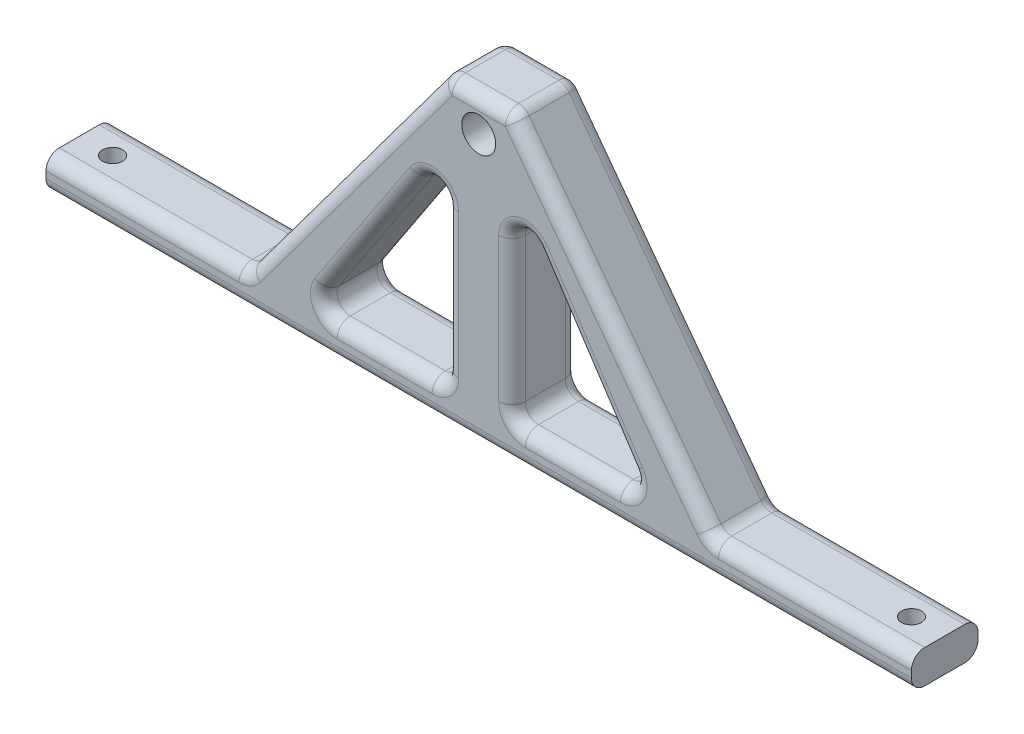
from build123d import *

# Parameters (mm, degrees)
SKETCH1_R           = 2.55
BOSS_EXTRUDE1_DEPTH = 10
SKETCH2_R           = 1.5
CUT_EXTRUDE1_DEPTH  = 5
FILLET1_R           = 2
FILLET2_R           = 2


with BuildPart() as part:
    # Sketch1 → Boss-Extrude1 (new body)
    with BuildSketch(Plane.XY):
        Polygon((-21.861045086, 19.601121192), (-11.861045086, 19.601121192), (18.138954914, -20.678878808), (48.138954914, -20.678878808), (48.138954914, -25.678878808), (-81.861045086, -25.678878808), (-81.861045086, -20.678878808), (-51.861045086, -20.678878808), align=None)
        with Locations((-16.861045086, 14.601121192)):
            Circle(SKETCH1_R, mode=Mode.SUBTRACT)
        Polygon((-41.861045086, -20.678878808), (-21.861045086, 9.601121192), (-21.861045086, -20.678878808), align=None, mode=Mode.SUBTRACT)
        Polygon((-11.861045086, 9.601121192), (-11.861045086, -20.678878808), (8.138954914, -20.678878808), align=None, mode=Mode.SUBTRACT)
    extrude(amount=BOSS_EXTRUDE1_DEPTH)

    # Sketch2 → Cut-Extrude1 (cut)
    with BuildSketch(Plane(origin=(0, -20.678878808, 0), x_dir=(1, 0, 0), z_dir=(0, 1, 0))):
        with Locations(Location((43.138954914, -5, 0), (0, 0, 180))):
            Circle(SKETCH2_R)
        with Locations(Location((-76.861045086, -5, 0), (0, 0, 180))):
            Circle(SKETCH2_R)
    extrude(amount=-CUT_EXTRUDE1_DEPTH, mode=Mode.SUBTRACT)

    # Fillet1
    fillet1_edges = [part.edges().sort_by_distance(p)[0] for p in [
        (-21.861045086, 19.601121192, 5),
        (-11.861045086, 19.601121192, 5),
        (18.138954914, -20.678878808, 5),
        (-51.861045086, -20.678878808, 5),
        (-41.861045086, -20.678878808, 5),
        (-21.861045086, -20.678878808, 5),
        (-21.861045086, 9.601121192, 5),
        (8.138954914, -20.678878808, 5),
        (-11.861045086, 9.601121192, 5),
        (-11.861045086, -20.678878808, 5),
    ]]
    fillet(fillet1_edges, radius=FILLET1_R)

    # Fillet2
    fillet2_edges = [part.edges().sort_by_distance(p)[0] for p in [
        (-16.861045086, -25.678878808, 10),
        (33.641047291, -20.678878808, 10),
        (-31.002101255, -20.678878808, 0),
        (-31.002101255, -20.678878808, 10),
        (-21.861045086, -7.867319769, 0),
        (-21.861045086, -7.867319769, 10),
        (-32.670934833, -6.765051884, 0),
        (-32.670934833, -6.765051884, 10),
        (-11.861045086, -7.867319769, 0),
        (-11.861045086, -7.867319769, 10),
        (-2.719988918, -20.678878808, 0),
        (-2.719988918, -20.678878808, 10),
        (-1.05115534, -6.765051884, 0),
        (-1.05115534, -6.765051884, 10),
        (-67.363137464, -20.678878808, 0),
        (-67.363137464, -20.678878808, 10),
        (-36.861045086, -0.538878808, 0),
        (-36.861045086, -0.538878808, 10),
        (3.138954914, -0.538878808, 0),
        (3.138954914, -0.538878808, 10),
        (-16.861045086, 19.601121192, 0),
        (-11.967812043, 19.388477142, 0),
        (-21.75427813, 19.388477142, 0),
        (-16.861045086, 19.601121192, 10),
        (-11.967812043, 19.388477142, 10),
        (-21.75427813, 19.388477142, 10),
        (-22.446831524, -20.093092371, 0),
        (-22.446831524, -20.093092371, 10),
        (-23.285574477, 4.859659218, 0),
        (33.641047291, -20.678878808, 0),
        (-23.285574477, 4.859659218, 10),
        (-39.904483028, -19.626366072, 0),
        (-39.904483028, -19.626366072, 10),
        (-11.275258649, -20.093092371, 0),
        (-11.275258649, -20.093092371, 10),
        (-10.436515696, 4.859659218, 0),
        (-10.436515696, 4.859659218, 10),
        (6.182392855, -19.626366072, 0),
        (6.182392855, -19.626366072, 10),
        (-51.967812043, -20.466234759, 0),
        (-51.967812043, -20.466234759, 10),
        (18.24572187, -20.466234759, 0),
        (18.24572187, -20.466234759, 10),
        (-16.861045086, -25.678878808, 0),
    ]]
    fillet(fillet2_edges, radius=FILLET2_R)


solid = part.part
